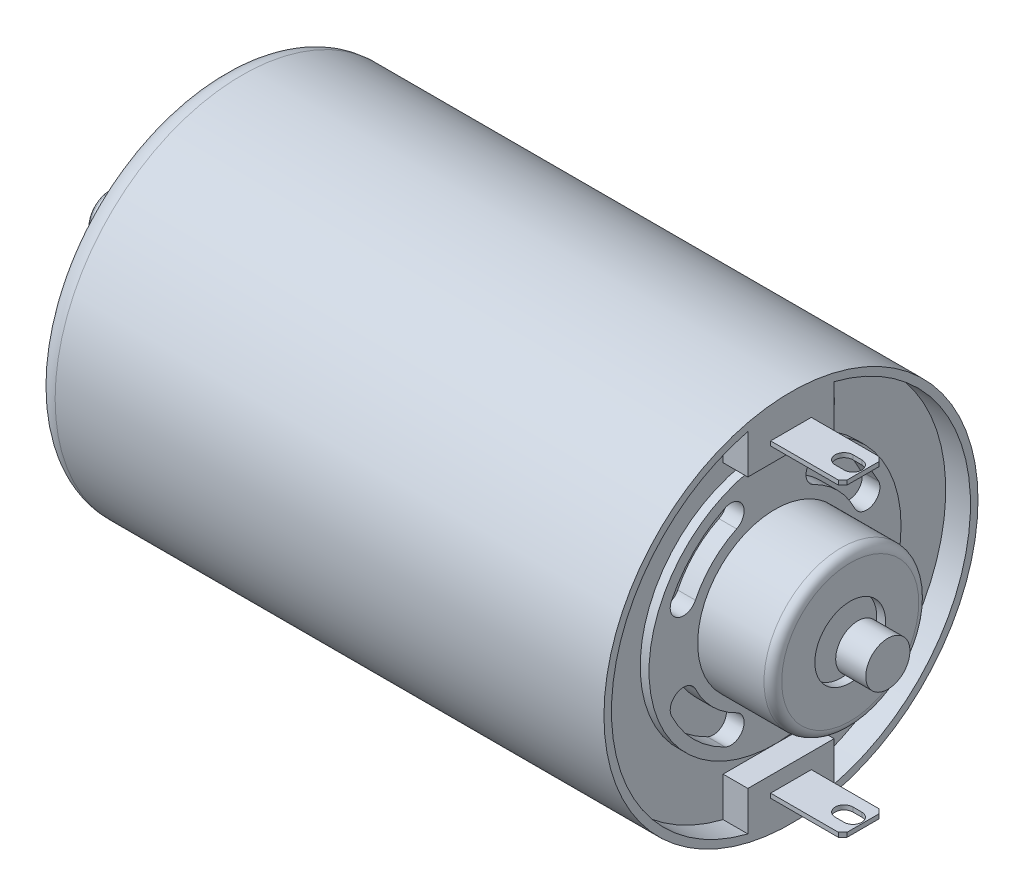
from build123d import *

# Parameters (mm, degrees)
SKETCH_1_W                       = 32.465011287
SKETCH_1_H                       = 21.15
SKETCH_2_R                       = 21.15
EXTRUDE_1_DEPTH                  = 25
SKETCH_3_W                       = 4.6
SKETCH_3_H                       = 0.5
EXTRUDE_2_DEPTH                  = 8.15
CUT_EXTRUDE_1_DEPTH              = 85.747296228
SKETCH_5_W                       = 4.6
SKETCH_5_H                       = 0.5
EXTRUDE_3_DEPTH                  = 8.15
CUT_EXTRUDE_2_REACH              = 86.747
CUT_EXTRUDE_3_DEPTH              = 2.8
SKETCH_8_R                       = 14.25
EXTRUDE_4_DEPTH                  = 1
CUT_EXTRUDE_4_DEPTH              = 2
CUT_EXTRUDE_5_DEPTH              = 2
CUT_EXTRUDE_6_DEPTH              = 2
CUT_EXTRUDE_7_DEPTH              = 2
EXTRUDE_START                    = 7.1
SKETCH_13_R                      = 21.15
EXTRUDE_5_DEPTH                  = 7.1
CUT_EXTRUDE_8_DEPTH              = 10
CUT_EXTRUDE_9_DEPTH              = 10
CUT_EXTRUDE_10_DEPTH             = 10
CUT_EXTRUDE_11_DEPTH             = 10
SKETCH_18_R                      = 8.75
EXTRUDE_6_DEPTH                  = 8.5
HOLE_WIZARD_8_0_8_1_D            = 8
HOLE_WIZARD_8_0_8_1_DEPTH        = 1
SKETCH_21_R                      = 8.9
EXTRUDE_7_DEPTH                  = 5
HOLE_WIZARD_M121_D               = 13.25
HOLE_WIZARD_M121_DEPTH           = 1
SKETCH_25_W                      = 3.4
SKETCH_25_H                      = 2.5
SKETCH_26_W                      = 1.25
SKETCH_26_H                      = 0.1
HOLE_WIZARD_3_3_3_3_1_AT_2_COUNT = 2
HOLE_WIZARD_3_3_3_3_1_AT_2_PITCH = 29
CHAMFER_1_SIZE                   = 0.5
FILLET_1_R                       = 0.25
FILLET_2_R                       = 0.75
FILLET_3_R                       = 1
FILLET_4_R                       = 2.5


with BuildPart() as part:
    # Эскиз1 → Повернуть1 (revolve)
    with BuildSketch(Plane.XY, mode=Mode.PRIVATE) as revolve_1_sk:
        with Locations((23.011963883, 10.575)):
            Rectangle(SKETCH_1_W, SKETCH_1_H)
    revolve(revolve_1_sk.sketch.rotate(Axis((6.779458239, 0, 0), (1, 0, 0)), 270), axis=Axis((6.779458239, 0, 0), (1, 0, 0)))

    # Эскиз2 → Бобышка-Вытянуть1 (add)
    with BuildSketch(Plane(origin=(39.244469526, 0, 0), x_dir=(0, 0, -1), z_dir=(1, 0, 0))):
        Circle(SKETCH_2_R)
    extrude(amount=EXTRUDE_1_DEPTH)

    # Эскиз3 → Бобышка-Вытянуть2 (add)
    with BuildSketch(Plane(origin=(64.244469526, 0, 0), x_dir=(0, 0, -1), z_dir=(1, 0, 0))):
        with Locations((0, 17.25)):
            Rectangle(SKETCH_3_W, SKETCH_3_H)
    extrude(amount=EXTRUDE_2_DEPTH)

    # Эскиз4 → Вырез-Вытянуть1 (cut, through all)
    with BuildSketch(Plane(origin=(0, 17.5, 0), x_dir=(-1, 0, 0), z_dir=(0, 1, 0))):
        with BuildLine():
            Line((-71.25, -1), (-70.25, -1))
            ThreePointArc((-70.25, -1), (-69.25, 0), (-70.25, 1))
            Line((-70.25, 1), (-71.25, 1))
            ThreePointArc((-71.25, 1), (-72.25, 0), (-71.25, -1))
        make_face()
    extrude(amount=-CUT_EXTRUDE_1_DEPTH, mode=Mode.SUBTRACT)

    # Эскиз5 → Бобышка-Вытянуть3 (add)
    with BuildSketch(Plane(origin=(64.244469526, 0, 0), x_dir=(0, 0, -1), z_dir=(1, 0, 0))):
        with Locations((0, -17.25)):
            Rectangle(SKETCH_5_W, SKETCH_5_H)
    extrude(amount=EXTRUDE_3_DEPTH)

    # Эскиз6 → Вырез-Вытянуть2 (cut, up to next)
    with BuildSketch(Plane.XZ.offset(17.5), mode=Mode.PRIVATE) as cut_extrude_2_sk1:
        with BuildLine():
            Line((71.25, 1), (70.25, 1))
            ThreePointArc((70.25, 1), (69.25, 0), (70.25, -1))
            Line((70.25, -1), (71.25, -1))
            ThreePointArc((71.25, -1), (72.25, 0), (71.25, 1))
        make_face()
    cut_extrude_2_tool1 = extrude(cut_extrude_2_sk1.sketch, amount=-CUT_EXTRUDE_2_REACH, mode=Mode.PRIVATE) & part.part
    add(cut_extrude_2_tool1.solids().sort_by_distance((70.75, -17.5, 0))[0], mode=Mode.SUBTRACT)

    # Эскиз7 → Вырез-Вытянуть3 (cut)
    with BuildSketch(Plane(origin=(64.244469526, 0, 0), x_dir=(0, 0, -1), z_dir=(1, 0, 0))):
        with BuildLine():
            Line((2.068879475, 14.25), (2.068879475, 15.25))
            Line((2.068879475, 15.25), (-4.875, 15.25))
            Line((-4.875, 15.25), (-4.875, 19.705947706))
            ThreePointArc((-4.875, 19.705947706), (-20.3, 0), (-4.875, -19.705947706))
            Line((-4.875, -19.705947706), (-4.875, -15.25))
            Line((-4.875, -15.25), (4.875, -15.25))
            Line((4.875, -15.25), (4.875, -19.705947706))
            ThreePointArc((4.875, -19.705947706), (20.3, 0), (4.875, 19.705947706))
            Line((4.875, 19.705947706), (4.875, 14.25))
            Line((4.875, 14.25), (2.068879475, 14.25))
        make_face()
    extrude(amount=-CUT_EXTRUDE_3_DEPTH, mode=Mode.SUBTRACT)

    # Эскиз8 → Бобышка-Вытянуть4 (add)
    with BuildSketch(Plane(origin=(61.444469526, 0, 0), x_dir=(0, 0, -1), z_dir=(1, 0, 0))):
        Circle(SKETCH_8_R)
    extrude(amount=EXTRUDE_4_DEPTH)

    # Эскиз9 → Вырез-Вытянуть4 (cut)
    with BuildSketch(Plane(origin=(62.444469526, 0, 0), x_dir=(0, 0, -1), z_dir=(1, 0, 0))):
        with BuildLine():
            ThreePointArc((-5.652173913, 11.706960752), (-9.192388155, 9.192388155), (-11.706960752, 5.652173913))
            ThreePointArc((-11.706960752, 5.652173913), (-11.008331502, 3.649196836), (-9.005354425, 4.347826087))
            ThreePointArc((-9.005354425, 4.347826087), (-7.071067812, 7.071067812), (-4.347826087, 9.005354425))
            ThreePointArc((-4.347826087, 9.005354425), (-3.649196836, 11.008331502), (-5.652173913, 11.706960752))
        make_face()
    extrude(amount=-CUT_EXTRUDE_4_DEPTH, mode=Mode.SUBTRACT)

    # Эскиз10 → Вырез-Вытянуть5 (cut)
    with BuildSketch(Plane(origin=(62.444469526, 0, 0), x_dir=(0, 0, -1), z_dir=(1, 0, 0))):
        with BuildLine():
            ThreePointArc((11.706960752, 5.652173913), (9.192388155, 9.192388155), (5.652173913, 11.706960752))
            ThreePointArc((5.652173913, 11.706960752), (3.649196836, 11.008331502), (4.347826087, 9.005354425))
            ThreePointArc((4.347826087, 9.005354425), (7.071067812, 7.071067812), (9.005354425, 4.347826087))
            ThreePointArc((9.005354425, 4.347826087), (11.008331502, 3.649196836), (11.706960752, 5.652173913))
        make_face()
    extrude(amount=-CUT_EXTRUDE_5_DEPTH, mode=Mode.SUBTRACT)

    # Эскиз11 → Вырез-Вытянуть6 (cut)
    with BuildSketch(Plane(origin=(62.444469526, 0, 0), x_dir=(0, 0, -1), z_dir=(1, 0, 0))):
        with BuildLine():
            ThreePointArc((5.652173913, -11.706960752), (9.192388155, -9.192388155), (11.706960752, -5.652173913))
            ThreePointArc((11.706960752, -5.652173913), (11.008331502, -3.649196836), (9.005354425, -4.347826087))
            ThreePointArc((9.005354425, -4.347826087), (7.071067812, -7.071067812), (4.347826087, -9.005354425))
            ThreePointArc((4.347826087, -9.005354425), (3.649196836, -11.008331502), (5.652173913, -11.706960752))
        make_face()
    extrude(amount=-CUT_EXTRUDE_6_DEPTH, mode=Mode.SUBTRACT)

    # Эскиз12 → Вырез-Вытянуть7 (cut)
    with BuildSketch(Plane(origin=(62.444469526, 0, 0), x_dir=(0, 0, -1), z_dir=(1, 0, 0))):
        with BuildLine():
            ThreePointArc((-11.706960752, -5.652173913), (-9.192388155, -9.192388155), (-5.652173913, -11.706960752))
            ThreePointArc((-5.652173913, -11.706960752), (-3.649196836, -11.008331502), (-4.347826087, -9.005354425))
            ThreePointArc((-4.347826087, -9.005354425), (-7.071067812, -7.071067812), (-9.005354425, -4.347826087))
            ThreePointArc((-9.005354425, -4.347826087), (-11.008331502, -3.649196836), (-11.706960752, -5.652173913))
        make_face()
    extrude(amount=-CUT_EXTRUDE_7_DEPTH, mode=Mode.SUBTRACT)

    # Эскиз13 → Бобышка-Вытянуть5 (add)
    with BuildSketch(Plane.ZY.offset(-6.779458239).offset(EXTRUDE_START)):
        with Locations(Location((0, 0, 0), (0, 0, 180))):
            Circle(SKETCH_13_R)
    extrude(amount=-EXTRUDE_5_DEPTH)

    # Эскиз14 → Вырез-Вытянуть8 (cut)
    with BuildSketch(Plane.ZY.offset(0.320541761)):
        with BuildLine():
            Line((6.761892188, 14.500924593), (4.775586358, 10.241277994))
            ThreePointArc((4.775586358, 10.241277994), (7.990306627, 7.990306627), (10.241277994, 4.775586358))
            Line((10.241277994, 4.775586358), (14.500924593, 6.761892188))
            ThreePointArc((14.500924593, 6.761892188), (11.313708499, 11.313708499), (6.761892188, 14.500924593))
        make_face()
    extrude(amount=-CUT_EXTRUDE_8_DEPTH, mode=Mode.SUBTRACT)

    # Эскиз15 → Вырез-Вытянуть9 (cut)
    with BuildSketch(Plane.ZY.offset(0.320541761)):
        with BuildLine():
            Line((-6.761892188, -14.500924593), (-4.775586358, -10.241277994))
            ThreePointArc((-4.775586358, -10.241277994), (-7.990306627, -7.990306627), (-10.241277994, -4.775586358))
            Line((-10.241277994, -4.775586358), (-14.500924593, -6.761892188))
            ThreePointArc((-14.500924593, -6.761892188), (-11.313708499, -11.313708499), (-6.761892188, -14.500924593))
        make_face()
    extrude(amount=-CUT_EXTRUDE_9_DEPTH, mode=Mode.SUBTRACT)

    # Эскиз16 → Вырез-Вытянуть10 (cut)
    with BuildSketch(Plane.ZY.offset(0.320541761)):
        with BuildLine():
            Line((-14.500924593, 6.761892188), (-10.241277994, 4.775586358))
            ThreePointArc((-10.241277994, 4.775586358), (-7.990306627, 7.990306627), (-4.775586358, 10.241277994))
            Line((-4.775586358, 10.241277994), (-6.761892188, 14.500924593))
            ThreePointArc((-6.761892188, 14.500924593), (-11.313708499, 11.313708499), (-14.500924593, 6.761892188))
        make_face()
    extrude(amount=-CUT_EXTRUDE_10_DEPTH, mode=Mode.SUBTRACT)

    # Эскиз17 → Вырез-Вытянуть11 (cut)
    with BuildSketch(Plane.ZY.offset(0.320541761)):
        with BuildLine():
            Line((14.500924593, -6.761892188), (10.241277994, -4.775586358))
            ThreePointArc((10.241277994, -4.775586358), (7.990306627, -7.990306627), (4.775586358, -10.241277994))
            Line((4.775586358, -10.241277994), (6.761892188, -14.500924593))
            ThreePointArc((6.761892188, -14.500924593), (11.313708499, -11.313708499), (14.500924593, -6.761892188))
        make_face()
    extrude(amount=-CUT_EXTRUDE_11_DEPTH, mode=Mode.SUBTRACT)

    # Эскиз18 → Бобышка-Вытянуть6 (add)
    with BuildSketch(Plane(origin=(62.444469526, 0, 0), x_dir=(0, 0, -1), z_dir=(1, 0, 0))):
        Circle(SKETCH_18_R)
    extrude(amount=EXTRUDE_6_DEPTH)

    # Диаметр отверстия Ø8.0 (8)1
    with Locations(Plane(origin=(70.944469526, 0, 0), x_dir=(0, 0, -1), z_dir=(1, 0, 0))):
        with Locations((0, 0)):
            Hole(HOLE_WIZARD_8_0_8_1_D / 2, depth=HOLE_WIZARD_8_0_8_1_DEPTH)

    # Эскиз21 → Бобышка-Вытянуть7 (add)
    with BuildSketch(Plane.ZY.offset(0.320541761)):
        Circle(SKETCH_21_R)
    extrude(amount=EXTRUDE_7_DEPTH)

    # Отверстие с зазором M121
    with Locations(Plane.ZY.offset(5.320541761)):
        with Locations((0, 0)):
            Hole(HOLE_WIZARD_M121_D / 2, depth=HOLE_WIZARD_M121_DEPTH)

    # Эскиз24 → Повернуть2 (revolve)
    with BuildSketch(Plane(origin=(0, 0, 0), x_dir=(-1, 0, 0), z_dir=(0, 0, -1)), mode=Mode.PRIVATE) as revolve_2_sk:
        Polygon((4, 3.75), (4, 0), (12.8, 0), (12.8, 2.5), (5, 2.5), (5, 3.75), align=None)
    revolve(revolve_2_sk.sketch.rotate(Axis((-4, 0, 0), (-1, 0, 0)), 270), axis=Axis((-4, 0, 0), (-1, 0, 0)))

    # Эскиз26 → Диаметр отверстия Ø2.5 (2.5)1 (revolve, cut)
    with BuildSketch(Plane(origin=(61.444469526, 15, -6.5), x_dir=(0, 0, -1), z_dir=(0, 1, 0))):
        with Locations((0.625, 0.05)):
            Rectangle(SKETCH_26_W, SKETCH_26_H)
    revolve(axis=Axis((67.794469526, 15, -6.5), (-1, 0, 0)), mode=Mode.SUBTRACT)

    # Эскиз28 → Диаметр отверстия Ø3.3 (3.3)1 (revolve, cut)
    with BuildSketch(Plane(origin=(-0.320541761, 14.5, 0), x_dir=(0, 0, 1), z_dir=(0, 1, 0))):
        Polygon((0, 0), (0, 12.491420021), (1.65, 11.5), (1.65, 0), align=None)
    hole_wizard_3_3_3_3_1 = revolve(axis=Axis((-6.670541761, 14.5, 0), (1, 0, 0)), mode=Mode.SUBTRACT)

    # Диаметр отверстия Ø3.3 (3.3)1 at 2: Диаметр отверстия Ø3.3 (3.3)1 ×2
    with Locations(*[(0, -i * HOLE_WIZARD_3_3_3_3_1_AT_2_PITCH, 0) for i in range(1, HOLE_WIZARD_3_3_3_3_1_AT_2_COUNT)]):
        add(hole_wizard_3_3_3_3_1, mode=Mode.SUBTRACT)

    # Фаска1
    chamfer_1_edges = [part.edges().sort_by_distance(p)[0] for p in [
        (72.394469526, 17.25, -2.3),
        (72.394469526, 17.25, 2.3),
        (72.394469526, -17.25, -2.3),
        (72.394469526, -17.25, 2.3),
    ]]
    chamfer(chamfer_1_edges, length=CHAMFER_1_SIZE)

    # Скругление1
    fillet_1_edges = [part.edges().sort_by_distance(p)[0] for p in [
        (-12.8, 0, -2.5),
    ]]
    fillet(fillet_1_edges, radius=FILLET_1_R)

    # Скругление2
    fillet_2_edges = [part.edges().sort_by_distance(p)[0] for p in [
        (-5.320541761, 0, -8.9),
    ]]
    fillet(fillet_2_edges, radius=FILLET_2_R)

    # Скругление3
    fillet_3_edges = [part.edges().sort_by_distance(p)[0] for p in [
        (70.944469526, 0, 8.75),
    ]]
    fillet(fillet_3_edges, radius=FILLET_3_R)

    # Скругление4
    fillet_4_edges = [part.edges().sort_by_distance(p)[0] for p in [
        (-0.320541761, 0, 21.15),
    ]]
    fillet(fillet_4_edges, radius=FILLET_4_R)


with BuildPart() as body_2:
    # Эскиз25 → Повернуть3 (revolve)
    with BuildSketch(Plane(origin=(0, 0, 0), x_dir=(-1, 0, 0), z_dir=(0, 0, -1)), mode=Mode.PRIVATE) as revolve_3_sk:
        with Locations((-73.5, 1.25)):
            Rectangle(SKETCH_25_W, SKETCH_25_H)
    revolve(revolve_3_sk.sketch.rotate(Axis((75.2, 0, 0), (-1, 0, 0)), 270), axis=Axis((75.2, 0, 0), (-1, 0, 0)))


solid = Compound([part.part, body_2.part])
